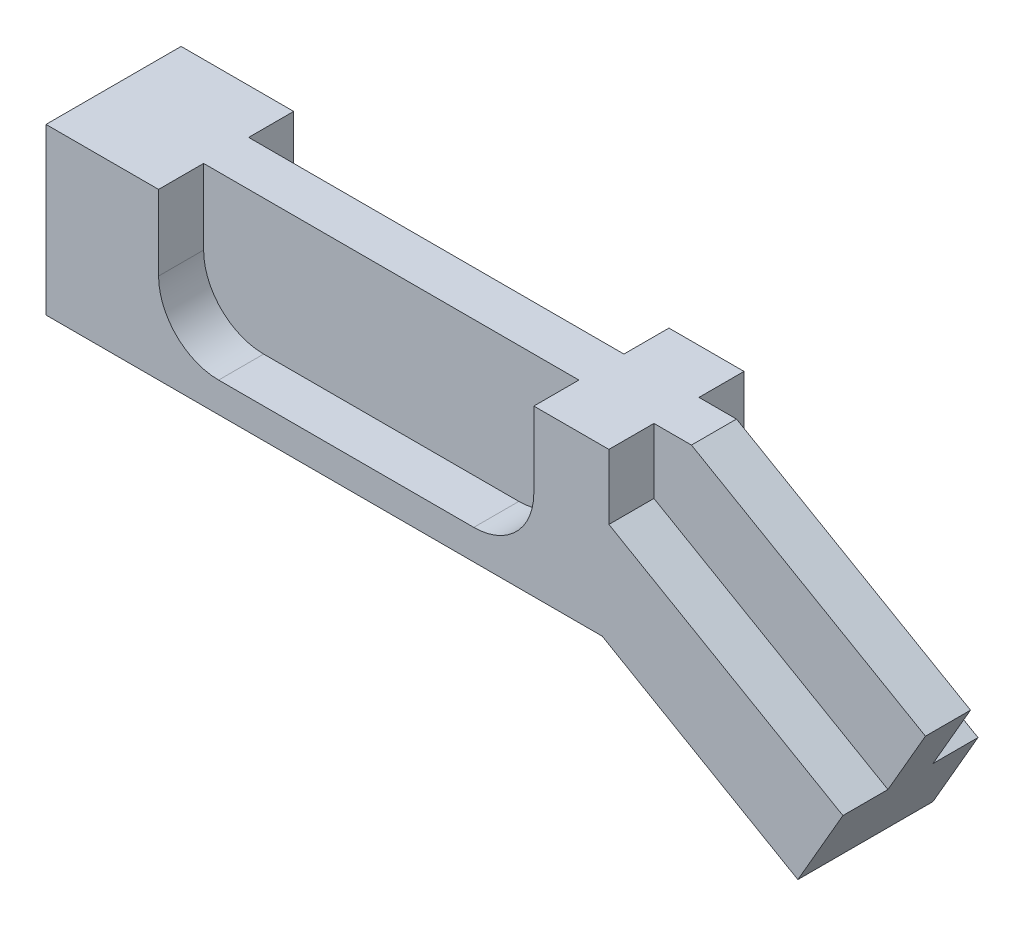
from build123d import *

# Parameters (mm, degrees)
EXTRUDE_1_DEPTH = 9
EXTRUDE_2_DEPTH = 3


with BuildPart() as part:
    # 스케치1 → 보스-돌출1 (new, symmetric)
    with BuildSketch(Plane.XY):
        with BuildLine():
            Line((75, -8.660254038), (75, 0))
            Line((75, 0), (65, 0))
            Line((65, 0), (65, -10))
            ThreePointArc((65, -10), (62.656854249, -15.656854249), (57, -18))
            Line((57, -18), (23, -18))
            ThreePointArc((23, -18), (17.343145751, -15.656854249), (15, -10))
            Line((15, -10), (15, 0))
            Line((15, 0), (0, 0))
            Line((0, 0), (0, -22))
            Line((0, -22), (74.105117767, -22))
            Line((74.105117767, -22), (100.176914536, -37.052558883))
            Line((100.176914536, -37.052558883), (106.176914536, -26.660254038))
            Line((106.176914536, -26.660254038), (75, -8.660254038))
        make_face()
    extrude(amount=EXTRUDE_1_DEPTH, both=True)

    # 스케치1<3> → 보스-돌출2 (add, symmetric)
    with BuildSketch(Plane.XY):
        Polygon((80, 0), (75, 0), (75, -8.660254038), (106.176914536, -26.660254038), (111.176914536, -18), align=None)
        with BuildLine():
            Line((65, -10), (65, 0))
            Line((65, 0), (15, 0))
            Line((15, 0), (15, -10))
            ThreePointArc((15, -10), (17.343145751, -15.656854249), (23, -18))
            Line((23, -18), (57, -18))
            ThreePointArc((57, -18), (62.656854249, -15.656854249), (65, -10))
        make_face()
    extrude(amount=EXTRUDE_2_DEPTH, both=True)


solid = part.part
